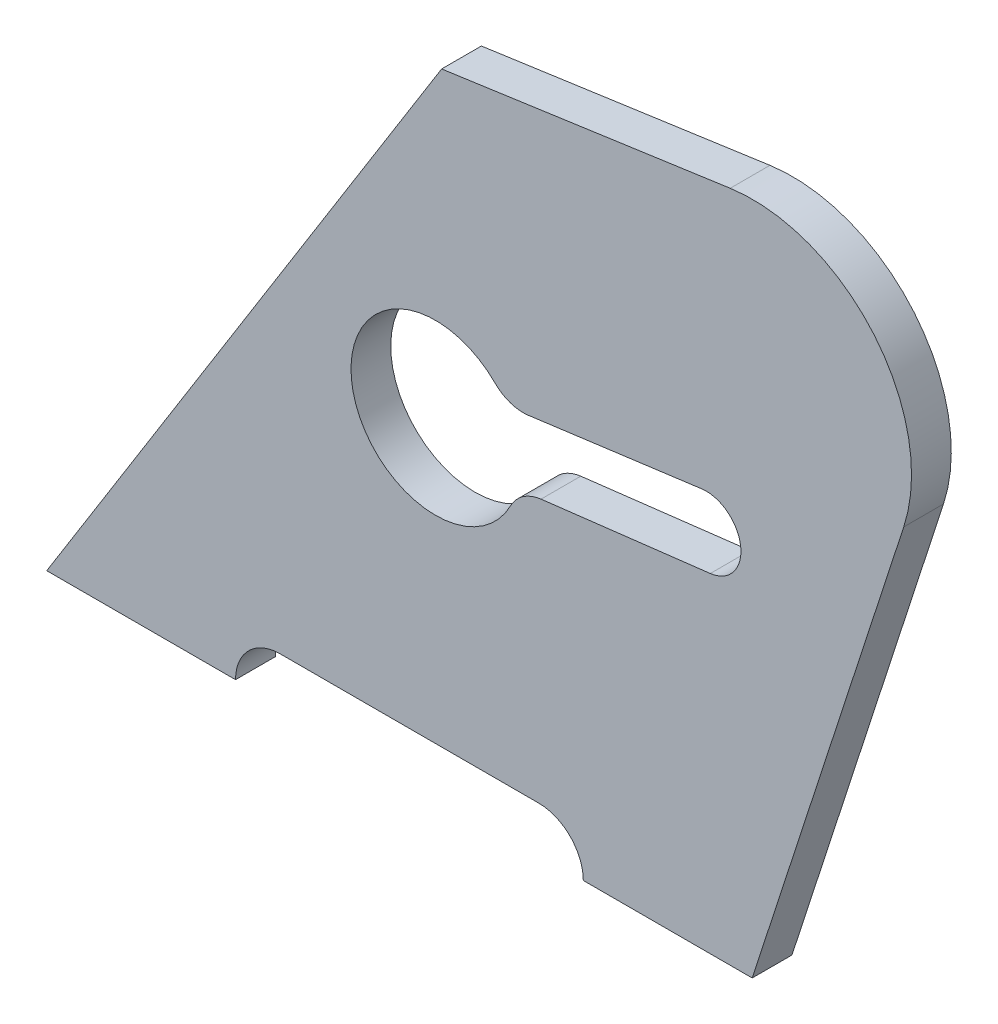
from build123d import *

# Parameters (mm, degrees)
BOSS_EXTRUDE1_DEPTH = 8


with BuildPart() as part:
    # Sketch2 → Boss-Extrude1 (new body)
    with BuildSketch(Plane.XY):
        with BuildLine():
            Line((79.487889635, 127.207214423), (37.624267761, 60.211414827))
            Line((37.624267761, 60.211414827), (61.402056741, 63.469750476))
            ThreePointArc((61.402056741, 63.469750476), (70.67132686, 80.997615577), (90.243088989, 77.820895466))
            ThreePointArc((90.243088989, 77.820895466), (93.32868479, 75.909168155), (96.941453957, 75.557740071))
            Line((96.941453957, 75.557740071), (131.814885044, 80.183965492))
            ThreePointArc((131.814885044, 80.183965492), (136.979315131, 78.811568483), (139.670612135, 74.195105322))
            Line((139.670612135, 74.195105322), (167.339393539, 77.986634336))
            Line((167.339393539, 77.986634336), (172.50354814, 93.880267937))
            ThreePointArc((172.50354814, 93.880267937), (166.569139078, 124.354715336), (137.573015724, 135.451290736))
            Line((137.573015724, 135.451290736), (79.487889635, 127.207214423))
        make_face()
        with BuildLine():
            Line((37.624267761, 60.211414827), (0, 0))
            Line((0, 0), (38, 0))
            ThreePointArc((38, 0), (40.636038969, 6.363961031), (47, 9))
            Line((47, 9), (99, 9))
            ThreePointArc((99, 9), (105.363961031, 6.363961031), (108, 0))
            Line((108, 0), (142, 0))
            Line((142, 0), (167.339393539, 77.986634336))
            Line((167.339393539, 77.986634336), (139.670612135, 74.195105322))
            ThreePointArc((139.670612135, 74.195105322), (138.274512361, 68.964746138), (133.565613448, 66.29416141))
            Line((133.565613448, 66.29416141), (99.495664198, 62.224794823))
            ThreePointArc((99.495664198, 62.224794823), (95.888310918, 60.857089082), (93.340518027, 57.960130667))
            ThreePointArc((93.340518027, 57.960130667), (75.354717379, 49.025178799), (61.402056741, 63.469750476))
            Line((61.402056741, 63.469750476), (37.624267761, 60.211414827))
        make_face()
    extrude(amount=BOSS_EXTRUDE1_DEPTH)


solid = part.part
